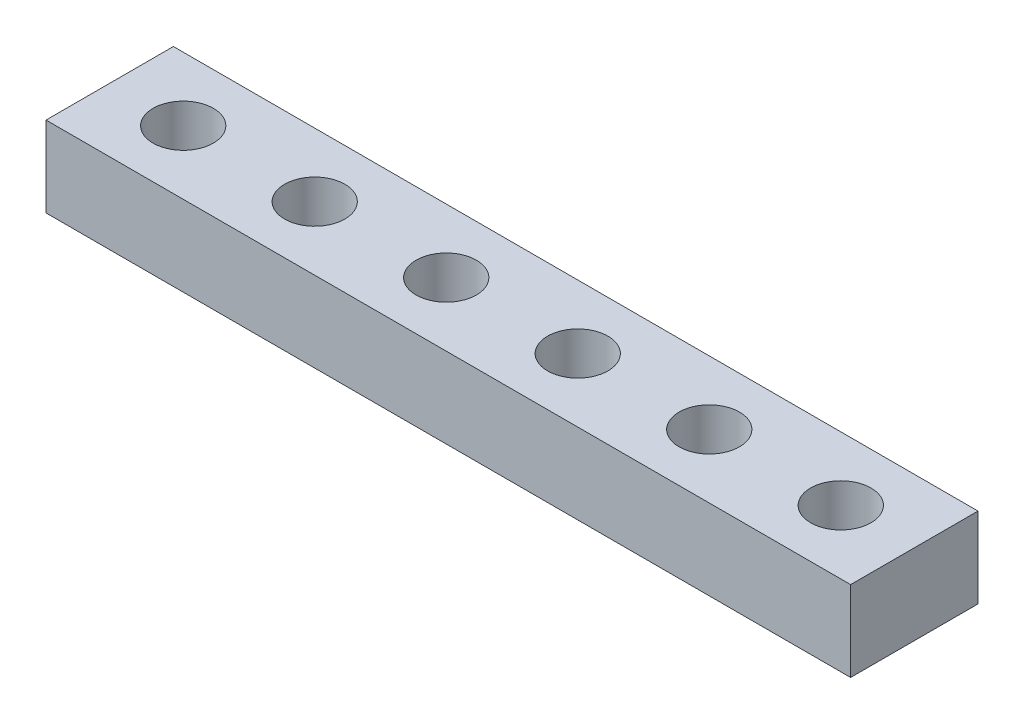
from build123d import *

# Parameters (mm, degrees)
SKETCH1_W           = 30
SKETCH1_H           = 4.75
SKETCH1_R           = 1.125
BOSS_EXTRUDE1_DEPTH = 3


with BuildPart() as part:
    # Sketch1 → Boss-Extrude1 (new body)
    with BuildSketch(Plane(origin=(0, 0, 0), x_dir=(1, 0, 0), z_dir=(0, 1, 0))):
        with Locations((15, -2.375)):
            Rectangle(SKETCH1_W, SKETCH1_H)
        with Locations(Location((2.740868037, -2.375, 0), (0, 0, 270))):
            Circle(SKETCH1_R, mode=Mode.SUBTRACT)
        with Locations(Location((7.644520822, -2.375, 0), (0, 0, 270))):
            Circle(SKETCH1_R, mode=Mode.SUBTRACT)
        with Locations(Location((12.548173607, -2.375, 0), (0, 0, 270))):
            Circle(SKETCH1_R, mode=Mode.SUBTRACT)
        with Locations(Location((17.451826393, -2.375, 0), (0, 0, 270))):
            Circle(SKETCH1_R, mode=Mode.SUBTRACT)
        with Locations(Location((22.355479178, -2.375, 0), (0, 0, 270))):
            Circle(SKETCH1_R, mode=Mode.SUBTRACT)
        with Locations(Location((27.259131963, -2.375, 0), (0, 0, 270))):
            Circle(SKETCH1_R, mode=Mode.SUBTRACT)
    extrude(amount=BOSS_EXTRUDE1_DEPTH)


solid = part.part
